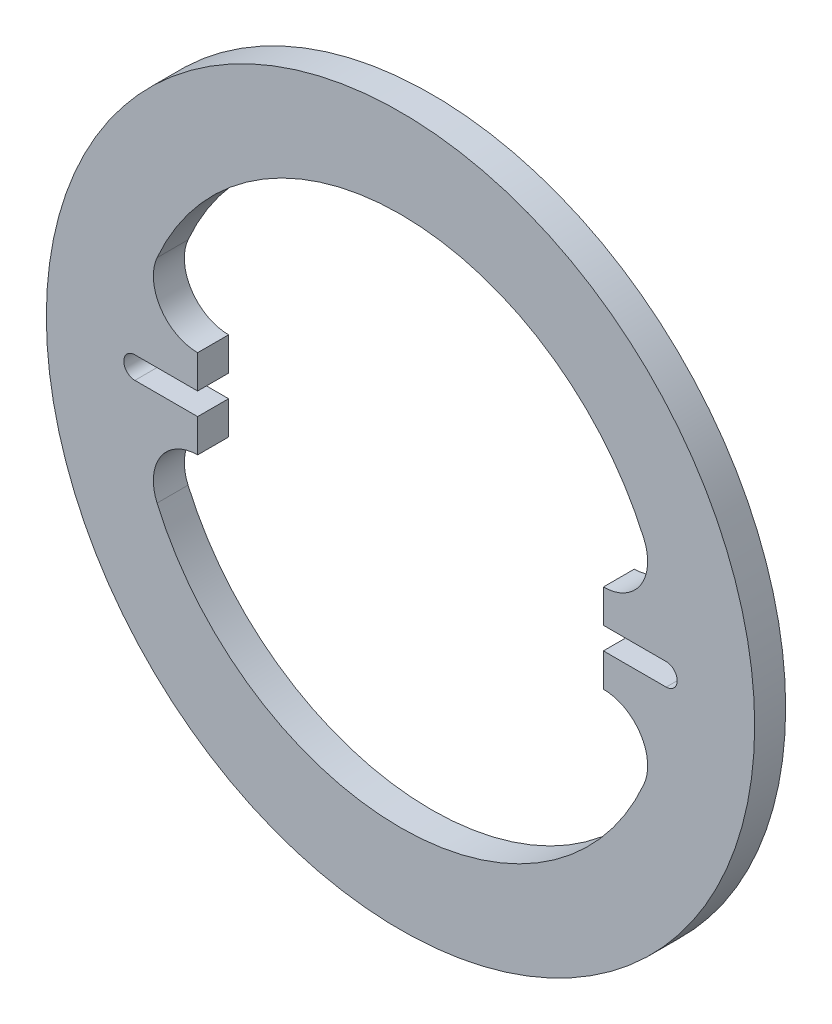
from build123d import *

# Parameters (mm, degrees)
SKETCH1_R           = 101.6
BOSS_EXTRUDE1_DEPTH = 8.89
SKETCH2_R           = 25.4
CUT_EXTRUDE1_DEPTH  = 144.95885558
CUT_EXTRUDE2_DEPTH  = 144.95885558
CUT_EXTRUDE3_DEPTH  = 144.95885558
CUT_EXTRUDE10_DEPTH = 144.95885558


with BuildPart() as part:
    # Sketch1 → Boss-Extrude1 (new body)
    with BuildSketch(Plane.XY):
        Circle(SKETCH1_R)
    extrude(amount=BOSS_EXTRUDE1_DEPTH)

    # Sketch2 → Cut-Extrude1 (cut, through all)
    with BuildSketch(Plane.XY.offset(8.89)):
        Circle(SKETCH2_R)
    extrude(amount=-CUT_EXTRUDE1_DEPTH, mode=Mode.SUBTRACT)

    # Sketch3 → Cut-Extrude2 (cut, through all)
    with BuildSketch(Plane.XY.offset(8.89)):
        with BuildLine():
            ThreePointArc((69.838453591, 30.48), (0, 76.2), (-69.838453591, 30.48))
            ThreePointArc((-69.838453591, 30.48), (-63.278711326, 13.760257735), (-46.558969061, 20.32))
            ThreePointArc((-46.558969061, 20.32), (0, 50.8), (46.558969061, 20.32))
            ThreePointArc((46.558969061, 20.32), (63.278711326, 13.760257735), (69.838453591, 30.48))
        make_face()
    cut_extrude2 = extrude(amount=-CUT_EXTRUDE2_DEPTH, mode=Mode.SUBTRACT)

    # Mirror1: Cut-Extrude2 across plane
    add(cut_extrude2.mirror(Plane.ZX), mode=Mode.SUBTRACT)

    # Sketch4 → Cut-Extrude3 (cut, through all)
    with BuildSketch(Plane.XY.offset(8.89)):
        with BuildLine():
            Line((76.2, -3.175), (25.4, -3.175))
            ThreePointArc((25.4, -3.175), (22.225, 0), (25.4, 3.175))
            Line((25.4, 3.175), (76.2, 3.175))
            ThreePointArc((76.2, 3.175), (79.375, 0), (76.2, -3.175))
        make_face()
        with BuildLine():
            Line((-76.2, -3.175), (-25.4, -3.175))
            ThreePointArc((-25.4, -3.175), (-22.225, 0), (-25.4, 3.175))
            Line((-25.4, 3.175), (-76.2, 3.175))
            ThreePointArc((-76.2, 3.175), (-79.375, 0), (-76.2, -3.175))
        make_face()
    extrude(amount=-CUT_EXTRUDE3_DEPTH, mode=Mode.SUBTRACT)

    # Sketch14 → Cut-Extrude10 (cut, through all)
    with BuildSketch(Plane.XY.offset(8.89)):
        with BuildLine():
            Line((-58.198711326, -12.7), (-58.198711326, 12.7))
            ThreePointArc((-58.198711326, 12.7), (-51.242634846, 14.774417663), (-46.558969061, 20.32))
            ThreePointArc((-46.558969061, 20.32), (0, 50.8), (46.558969061, 20.32))
            ThreePointArc((46.558969061, 20.32), (51.242634846, 14.774417663), (58.198711326, 12.7))
            Line((58.198711326, 12.7), (58.198711326, -12.7))
            ThreePointArc((58.198711326, -12.7), (51.242634846, -14.774417663), (46.558969061, -20.32))
            ThreePointArc((46.558969061, -20.32), (0, -50.8), (-46.558969061, -20.32))
            ThreePointArc((-46.558969061, -20.32), (-51.242634846, -14.774417663), (-58.198711326, -12.7))
        make_face()
    extrude(amount=-CUT_EXTRUDE10_DEPTH, mode=Mode.SUBTRACT)


solid = part.part
